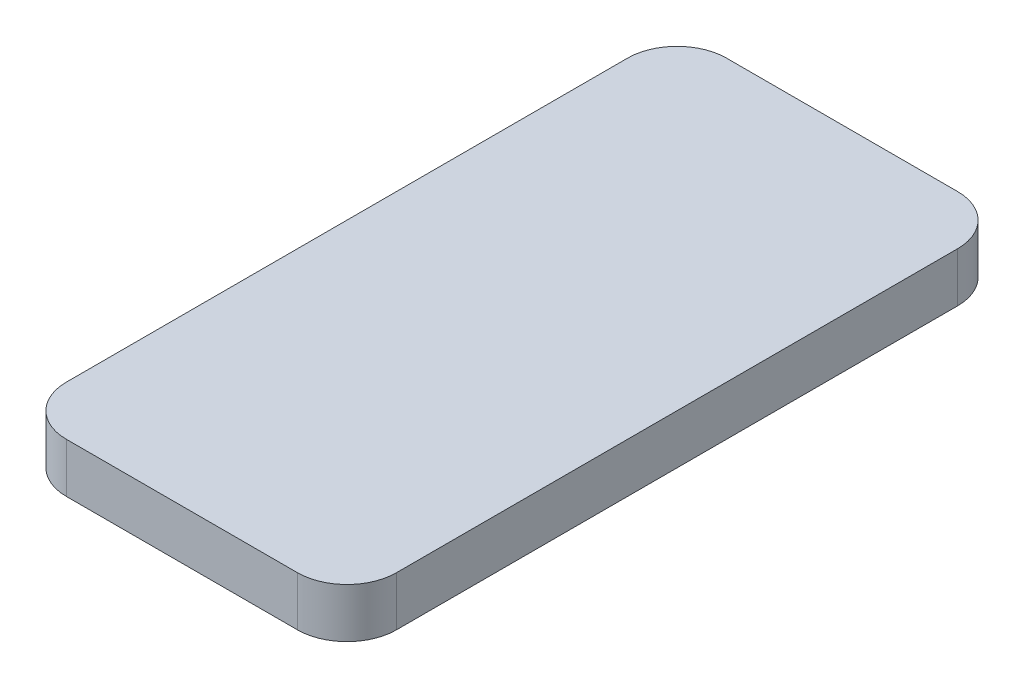
from build123d import *

# Parameters (mm, degrees)
SKETCH_1_W      = 20
SKETCH_1_H      = 40
EXTRUDE_1_DEPTH = 3
FILLET_1_R      = 3


with BuildPart() as part:
    # 草图1 → 凸台-拉伸1 (new body)
    with BuildSketch(Plane(origin=(0, 0, 0), x_dir=(1, 0, 0), z_dir=(0, 1, 0))):
        with Locations((10, 20)):
            Rectangle(SKETCH_1_W, SKETCH_1_H)
    extrude(amount=EXTRUDE_1_DEPTH)

    # 圆角1
    fillet_1_edges = [part.edges().sort_by_distance(p)[0] for p in [
        (0, 1.5, -40),
        (20, 1.5, -40),
        (20, 1.5, 0),
        (0, 1.5, 0),
    ]]
    fillet(fillet_1_edges, radius=FILLET_1_R)


solid = part.part
